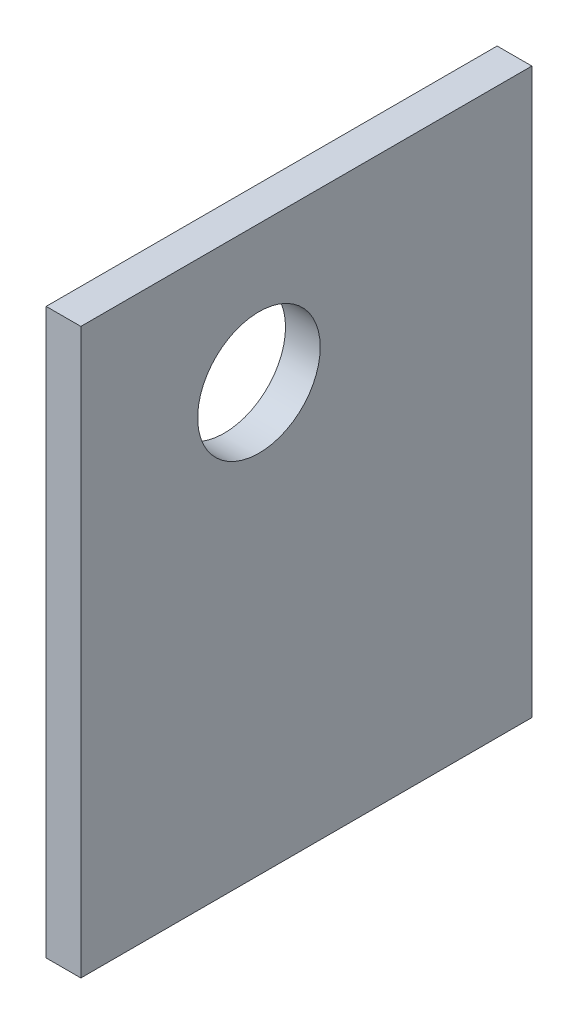
from build123d import *

# Parameters (mm, degrees)
CROQUIS2_W              = 244
CROQUIS2_H              = 195
CROQUIS2_R              = 26.5
SALIENTE_EXTRUIR1_DEPTH = 15


with BuildPart() as part:
    # Croquis2 → Saliente-Extruir1 (new body)
    with BuildSketch(Plane.YZ):
        with Locations((122, 97.5)):
            Rectangle(CROQUIS2_W, CROQUIS2_H)
        with Locations(Location((184.5, 118, 0), (0, 0, 270))):
            Circle(CROQUIS2_R, mode=Mode.SUBTRACT)
    extrude(amount=SALIENTE_EXTRUIR1_DEPTH)


solid = part.part
